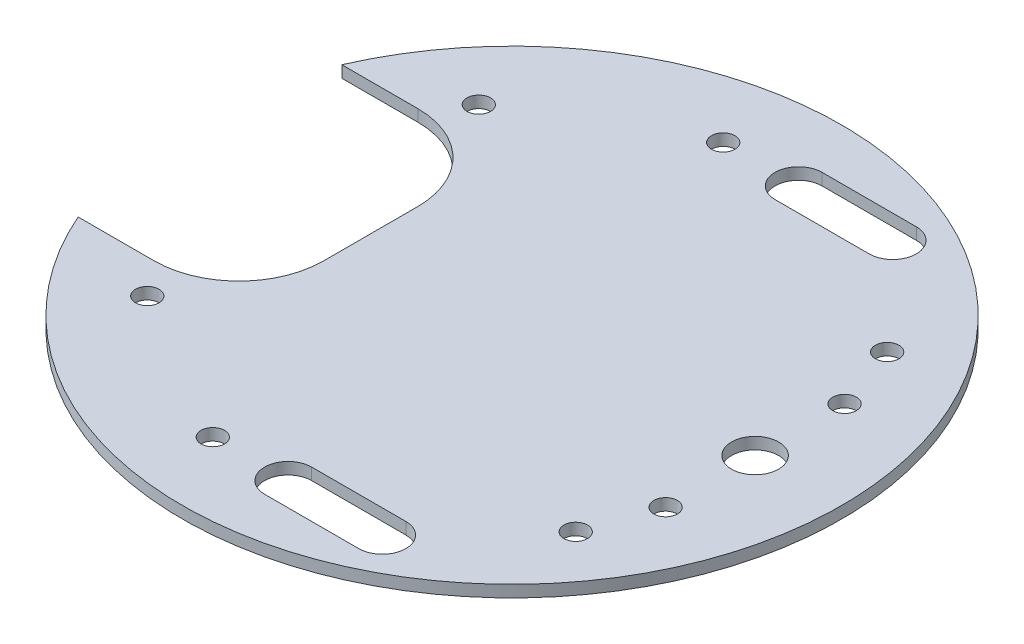
from build123d import *

# Parameters (mm, degrees)
SKETCH2_R           = 88.9
BOSS_EXTRUDE1_DEPTH = 3.175
SKETCH3_R           = 3.175
SKETCH3_W           = 50.8
SKETCH3_H           = 71.12
CUT_EXTRUDE1_DEPTH  = 3.175
FILLET1_R           = 22.86
SKETCH6_R           = 6.35
CUT_EXTRUDE3_DEPTH  = 126.763669734
SKETCH8_R           = 3.175
CUT_EXTRUDE4_DEPTH  = 10


with BuildPart() as part:
    # Sketch2 → Boss-Extrude1 (new body)
    with BuildSketch(Plane(origin=(0, 0, 0), x_dir=(1, 0, 0), z_dir=(0, 1, 0))):
        with Locations(Location((0, 0, 0), (0, 0, 270))):
            Circle(SKETCH2_R)
    extrude(amount=BOSS_EXTRUDE1_DEPTH)

    # Sketch3 → Cut-Extrude1 (cut)
    with BuildSketch(Plane(origin=(0, 3.175, 0), x_dir=(1, 0, 0), z_dir=(0, 1, 0))):
        with Locations(Location((65.549718535, -24.13, 0), (0, 0, 270))):
            Circle(SKETCH3_R)
        with Locations(Location((65.549718535, 24.13, 0), (0, 0, 270))):
            Circle(SKETCH3_R)
        with Locations(Location((-53.672052261, 44.702721462, 0), (0, 0, 270))):
            Circle(SKETCH3_R)
        with Locations(Location((-11.877666274, 68.832721462, 0), (0, 0, 270))):
            Circle(SKETCH3_R)
        with Locations(Location((-11.877666274, -68.832721462, 0), (0, 0, 270))):
            Circle(SKETCH3_R)
        with Locations(Location((-53.672052261, -44.702721462, 0), (0, 0, 270))):
            Circle(SKETCH3_R)
        with Locations((-63.5, 0)):
            Rectangle(SKETCH3_W, SKETCH3_H)
    extrude(amount=-CUT_EXTRUDE1_DEPTH, mode=Mode.SUBTRACT)

    # Fillet1
    fillet1_edges = [part.edges().sort_by_distance(p)[0] for p in [
        (-38.1, 1.5875, 35.56),
        (-38.1, 1.5875, -35.56),
    ]]
    fillet(fillet1_edges, radius=FILLET1_R)

    # Sketch6 → Cut-Extrude3 (cut, through all)
    with BuildSketch(Plane(origin=(0, 3.175, 0), x_dir=(1, 0, 0), z_dir=(0, 1, 0))):
        with Locations(Location((65.549718535, 0, 0), (0, 0, 270))):
            Circle(SKETCH6_R)
        with BuildLine():
            Line((8.442333726, 75.182721462), (33.842333726, 75.182721462))
            ThreePointArc((33.842333726, 75.182721462), (40.192333726, 68.832721462), (33.842333726, 62.482721462))
            Line((33.842333726, 62.482721462), (8.442333726, 62.482721462))
            ThreePointArc((8.442333726, 62.482721462), (2.092333726, 68.832721462), (8.442333726, 75.182721462))
        make_face()
        with BuildLine():
            Line((8.442333726, -62.482721462), (33.842333726, -62.482721462))
            ThreePointArc((33.842333726, -62.482721462), (40.192333726, -68.832721462), (33.842333726, -75.182721462))
            Line((33.842333726, -75.182721462), (8.442333726, -75.182721462))
            ThreePointArc((8.442333726, -75.182721462), (2.092333726, -68.832721462), (8.442333726, -62.482721462))
        make_face()
    extrude(amount=-CUT_EXTRUDE3_DEPTH, mode=Mode.SUBTRACT)

    # Sketch8 → Cut-Extrude4 (cut)
    with BuildSketch(Plane(origin=(0, 3.175, 0), x_dir=(1, 0, 0), z_dir=(0, 1, 0))):
        with Locations(Location((59.175, 42, 0), (0, 0, 270))):
            Circle(SKETCH8_R)
    cut_extrude4 = extrude(amount=-CUT_EXTRUDE4_DEPTH, mode=Mode.SUBTRACT)

    # Mirror1: Cut-Extrude4 across plane
    add(cut_extrude4.mirror(Plane.XY), mode=Mode.SUBTRACT)


solid = part.part
